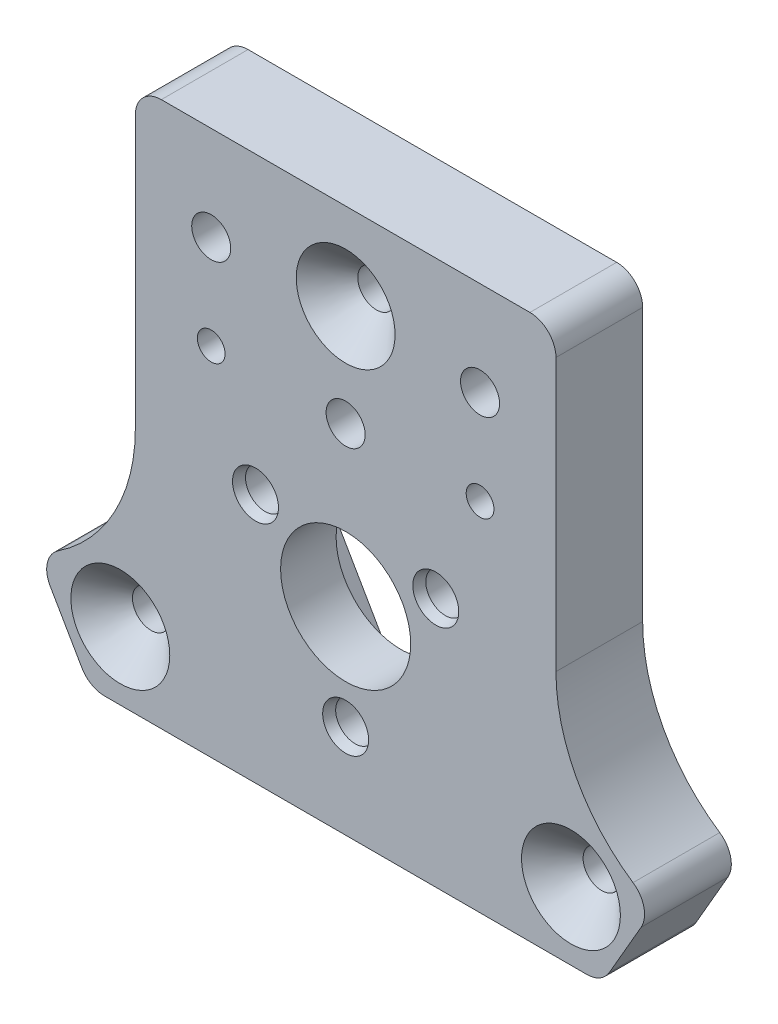
from build123d import *

# Parameters (mm, degrees)
SKETCH2_R                                       = 7.5
BOSS_EXTRUDE1_DEPTH                             = 10
CSK_FOR_M4_FLAT_HEAD_MACHINE_SCREW1_D           = 4.3
CSK_FOR_M4_FLAT_HEAD_MACHINE_SCREW1_CSINK_D     = 11.4
CSK_FOR_M4_FLAT_HEAD_MACHINE_SCREW1_CSINK_ANGLE = 90
FILLET1_R                                       = 20
V_GROOVE_CUTOUT_DEPTH                           = 3.6
STANDARD_TAPERED_INSERT_CUTOUT_DEPTH            = 55.436206513
STANDARD_TAPERED_INSERT_CUTOUT_DEPTH_BACK       = 55.436206513
SKETCH13_R                                      = 2.25
TAPER_FOR_INSERTS_SIZE                          = 0.4
TAPER_FOR_INSERTS_SIZE2                         = 1.098990968
MOVE_FACE1_BY                                   = 0.5
MOVE_FACE1_2_BY                                 = 0.5
MOVE_FACE1_3_BY                                 = 0.5
MOVE_FACE1_4_BY                                 = 0.5
MOVE_FACE1_5_BY                                 = 0.5
MOVE_FACE1_6_BY                                 = 0.5
CIRPATTERN2_COUNT                               = 3
SKETCH47_R                                      = 1.6
CUT_EXTRUDE1_DEPTH                              = 55.436206513
CSK_FOR_M4_FLAT_HEAD_MACHINE_SCREW2_D           = 4.5
CSK_FOR_M4_FLAT_HEAD_MACHINE_SCREW2_DEPTH       = 10.1
CSK_FOR_M4_FLAT_HEAD_MACHINE_SCREW2_CSINK_D     = 9.4
CSK_FOR_M4_FLAT_HEAD_MACHINE_SCREW2_CSINK_ANGLE = 90
CSK_FOR_M4_FLAT_HEAD_MACHINE_SCREW2_TIP         = 1.351936393
FILLET2_R                                       = 3


with BuildPart() as part:
    # Sketch2 → Boss-Extrude1 (new body)
    with BuildSketch(Plane.XY):
        Polygon((-24.25, 40), (24.25, 40), (24.25, -5.917840259), (35.54293994, -12.437822174), (29.54293994, -22.830127019), (-29.54293994, -22.830127019), (-35.54293994, -12.437822174), (-24.25, -5.917840259), align=None)
        Circle(SKETCH2_R, mode=Mode.SUBTRACT)
    extrude(amount=BOSS_EXTRUDE1_DEPTH)

    # CSK for M4 Flat Head Machine Screw1 (through all)
    with Locations(Plane.XY.offset(10)):
        with Locations((-25.980762114, -15), (0, 30), (25.980762114, -15)):
            CounterSinkHole(CSK_FOR_M4_FLAT_HEAD_MACHINE_SCREW1_D / 2, CSK_FOR_M4_FLAT_HEAD_MACHINE_SCREW1_CSINK_D / 2, counter_sink_angle=CSK_FOR_M4_FLAT_HEAD_MACHINE_SCREW1_CSINK_ANGLE)

    # Fillet1
    fillet1_edges = [part.edges().sort_by_distance(p)[0] for p in [
        (24.25, -5.917840259, 5),
        (-24.25, -5.917840259, 5),
    ]]
    fillet(fillet1_edges, radius=FILLET1_R)

    # Sketch44 → v-groove cutout (cut)
    with BuildSketch(Plane(origin=(0, 0, 0), x_dir=(-1, 0, 0), z_dir=(0, 0, -1))):
        with BuildLine():
            Line((10.392304845, 10), (-10.392304845, 10))
            ThreePointArc((-10.392304845, 10), (-13.856406461, 8), (-13.856406461, 4))
            Line((-13.856406461, 4), (-3.464101615, -14))
            ThreePointArc((-3.464101615, -14), (0, -16), (3.464101615, -14))
            Line((3.464101615, -14), (13.856406461, 4))
            ThreePointArc((13.856406461, 4), (13.856406461, 8), (10.392304845, 10))
        make_face()
    extrude(amount=-V_GROOVE_CUTOUT_DEPTH, mode=Mode.SUBTRACT)

    # Sketch13 → standard tapered insert cutout (cut, two sides: drawn at the far end of the back side and taken through both)
    with BuildSketch(Plane(origin=(0, 0, 0), x_dir=(-1, 0, 0), z_dir=(0, 0, -1)).offset(-STANDARD_TAPERED_INSERT_CUTOUT_DEPTH_BACK)):
        with Locations((-10.392304845, 6)):
            Circle(SKETCH13_R)
        with Locations((10.392304845, 6)):
            Circle(SKETCH13_R)
        with Locations((0, -12)):
            Circle(SKETCH13_R)
    extrude(amount=STANDARD_TAPERED_INSERT_CUTOUT_DEPTH + STANDARD_TAPERED_INSERT_CUTOUT_DEPTH_BACK, mode=Mode.SUBTRACT)

    # taper for inserts
    taper_for_inserts_edges = [part.edges().sort_by_distance(p)[0] for p in [
        (12.642304845, 6, 10),
        (-8.142304845, 6, 10),
        (2.25, -12, 10),
    ]]
    taper_for_inserts_side = [part.faces().sort_by_distance(p)[0] for p in [
        (0, 7.937962268, 10),
    ]]
    chamfer(taper_for_inserts_edges, length=TAPER_FOR_INSERTS_SIZE, length2=TAPER_FOR_INSERTS_SIZE2, reference=taper_for_inserts_side[0])

    # Move Face1: a face moved inward by 0.5
    extrude(part.faces().sort_by_distance((-8.660254038, -5, 1.8))[0], amount=MOVE_FACE1_BY, dir=(-0.866025404, -0.5, 0), mode=Mode.SUBTRACT)

    # Move Face1 2: a curved face moved inward by 0.5
    add(Solid.thicken(part.faces().sort_by_distance((0, -16, 1.8))[0], -MOVE_FACE1_2_BY), mode=Mode.SUBTRACT)

    # Move Face1 3: a face moved inward by 0.5
    extrude(part.faces().sort_by_distance((8.660254038, -5, 1.8))[0], amount=MOVE_FACE1_3_BY, dir=(0.866025404, -0.5, 0), mode=Mode.SUBTRACT)

    # Move Face1 4: a curved face moved inward by 0.5
    add(Solid.thicken(part.faces().sort_by_distance((13.856406461, 8, 1.8))[0], -MOVE_FACE1_4_BY), mode=Mode.SUBTRACT)

    # Move Face1 5: a curved face moved inward by 0.5
    add(Solid.thicken(part.faces().sort_by_distance((-13.856406461, 8, 1.8))[0], -MOVE_FACE1_5_BY), mode=Mode.SUBTRACT)

    # Move Face1 6: a face moved inward by 0.5
    extrude(part.faces().sort_by_distance((0, 10, 1.8))[0], amount=MOVE_FACE1_6_BY, dir=(0, 1, 0), mode=Mode.SUBTRACT)

    # Sketch46 → tool ball cutout (revolve, cut)
    with BuildSketch(Plane(origin=(0, 30, 0), x_dir=(1, 0, 0), z_dir=(0, 1, 0))):
        with BuildLine():
            Line((0, 5.3), (0, -4.7))
            ThreePointArc((0, -4.7), (-5, 0.3), (0, 5.3))
        make_face()
    tool_ball_cutout = revolve(axis=Axis((0, 30, 0), (0, 0, -1)), mode=Mode.SUBTRACT)

    # CirPattern2: tool ball cutout ×3 about axis
    cirpattern2_axis = Axis((0, 0, 0), (0, 0, 1))
    for i in range(1, CIRPATTERN2_COUNT):
        add(tool_ball_cutout.rotate(cirpattern2_axis, i * 360 / CIRPATTERN2_COUNT), mode=Mode.SUBTRACT)

    # Sketch47 → Cut-Extrude1 (cut, through all)
    with BuildSketch(Plane(origin=(0, 0, 0), x_dir=(-1, 0, 0), z_dir=(0, 0, -1))):
        with Locations((-15.5, 18.269872981)):
            Circle(SKETCH47_R)
        with Locations((15.5, 18.269872981)):
            Circle(SKETCH47_R)
    extrude(amount=-CUT_EXTRUDE1_DEPTH, mode=Mode.SUBTRACT)

    # CSK for M4 Flat Head Machine Screw2
    with Locations(Plane(origin=(0, 0, 0), x_dir=(-1, 0, 0), z_dir=(0, 0, -1))):
        with Locations((-15.5, 29.134936491), (0, 18.269872981), (15.5, 29.134936491)):
            CounterSinkHole(CSK_FOR_M4_FLAT_HEAD_MACHINE_SCREW2_D / 2, CSK_FOR_M4_FLAT_HEAD_MACHINE_SCREW2_CSINK_D / 2, depth=CSK_FOR_M4_FLAT_HEAD_MACHINE_SCREW2_DEPTH, counter_sink_angle=CSK_FOR_M4_FLAT_HEAD_MACHINE_SCREW2_CSINK_ANGLE)
            with Locations((0, 0, -(CSK_FOR_M4_FLAT_HEAD_MACHINE_SCREW2_DEPTH + CSK_FOR_M4_FLAT_HEAD_MACHINE_SCREW2_TIP / 2))):  # 118° drill point
                Cone(0, CSK_FOR_M4_FLAT_HEAD_MACHINE_SCREW2_D / 2, CSK_FOR_M4_FLAT_HEAD_MACHINE_SCREW2_TIP, mode=Mode.SUBTRACT)

    # Fillet2
    fillet2_edges = [part.edges().sort_by_distance(p)[0] for p in [
        (24.25, 40, 5),
        (-24.25, 40, 5),
        (-29.54293994, -22.830127019, 5),
        (-35.54293994, -12.437822174, 5),
        (29.54293994, -22.830127019, 5),
        (35.54293994, -12.437822174, 5),
    ]]
    fillet(fillet2_edges, radius=FILLET2_R)


solid = part.part
